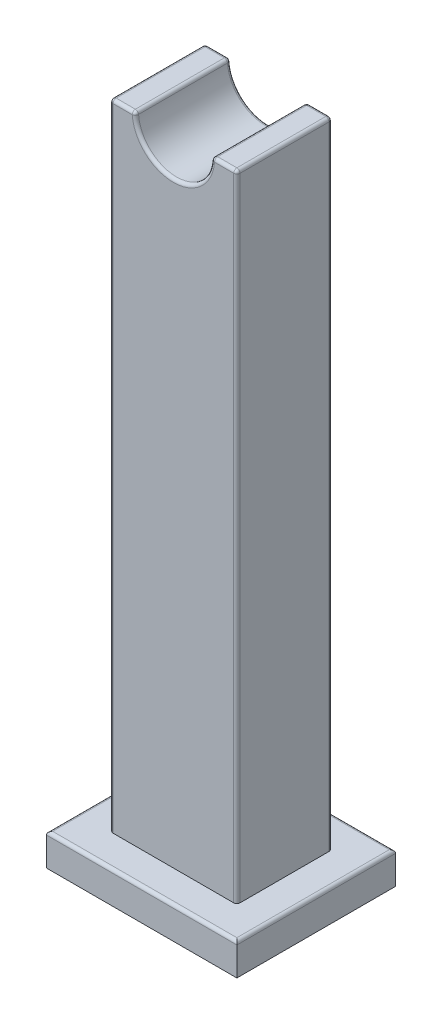
from build123d import *

# Parameters (mm, degrees)
BOSS_EXTRU_1_DEPTH = 15
ESQUISSE2_W        = 30
ESQUISSE2_H        = 25
BOSS_EXTRU_2_DEPTH = 5
CONG_1_R           = 0.5


with BuildPart() as part:
    # Esquisse1 → Boss.-Extru.1 (new body)
    with BuildSketch(Plane.XY):
        with BuildLine():
            Line((6, 0), (10, 0))
            Line((10, 0), (10, -100))
            Line((10, -100), (-10, -100))
            Line((-10, -100), (-10, 0))
            Line((-10, 0), (-6, 0))
            ThreePointArc((-6, 0), (0, -6), (6, 0))
        make_face()
    extrude(amount=BOSS_EXTRU_1_DEPTH)

    # Esquisse2 → Boss.-Extru.2 (add)
    with BuildSketch(Plane.XZ.offset(100)):
        with Locations((0, 7.5)):
            Rectangle(ESQUISSE2_W, ESQUISSE2_H)
    extrude(amount=BOSS_EXTRU_2_DEPTH)

    # Congé1
    cong_1_edges = [part.edges().sort_by_distance(p)[0] for p in [
        (10, -50, 15),
        (-10, 0, 7.5),
        (-6, 0, 7.5),
        (6, 0, 7.5),
        (10, 0, 7.5),
        (8, 0, 15),
        (0, -6, 15),
        (-15, -100, 7.5),
        (-8, 0, 15),
        (0, -100, -5),
        (15, -100, 7.5),
        (0, -100, 20),
        (-10, -50, 15),
        (-8, 0, 0),
        (0, -6, 0),
        (8, 0, 0),
        (10, -50, 0),
        (-10, -50, 0),
    ]]
    fillet(cong_1_edges, radius=CONG_1_R)


solid = part.part
